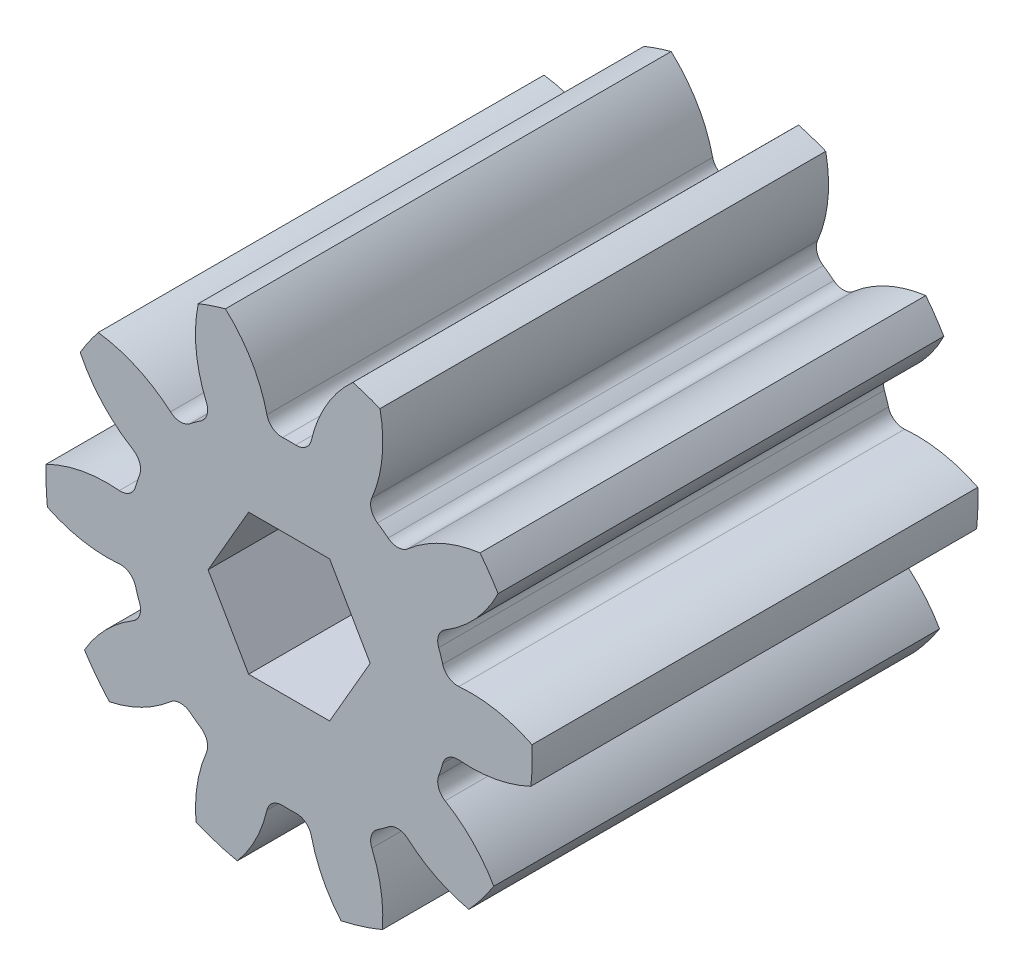
from build123d import *

# Parameters (mm, degrees)
SKETCH1_R                = 6
BOSS_EXTRUDE1_DEPTH      = 11
CUT_EXTRUDE1_DEPTH       = 11
FILLET2_R                = 0.38
CIRPATTERN2_COUNT        = 10
FILLET2_OF_CIRPATTERN2_R = 0.38
CUT_EXTRUDE2_DEPTH       = 14.833348455


with BuildPart() as part:
    # Sketch1 → Boss-Extrude1 (new body)
    with BuildSketch(Plane.XY):
        Circle(SKETCH1_R)
    extrude(amount=-BOSS_EXTRUDE1_DEPTH)

    # Sketch1<4> → Cut-Extrude1 (cut)
    with BuildSketch(Plane.XY):
        with BuildLine():
            ThreePointArc((-0.489473221, 3.71791823), (0, 3.75), (0.489473221, 3.71791823))
            ThreePointArc((0.489473221, 3.71791823), (0.847239998, 4.849979865), (1.571872072, 5.790441968))
            ThreePointArc((1.571872072, 5.790441968), (0, 6), (-1.571872072, 5.790441968))
            ThreePointArc((-1.571872072, 5.790441968), (-0.847239998, 4.849979865), (-0.489473221, 3.71791823))
        make_face()
    cut_extrude1 = extrude(amount=-CUT_EXTRUDE1_DEPTH, mode=Mode.SUBTRACT)

    # Fillet2
    fillet2_edges = [part.edges().sort_by_distance(p)[0] for p in [
        (0.489473221, 3.71791823, -5.5),
        (-0.489473221, 3.71791823, -5.5),
    ]]
    fillet(fillet2_edges, radius=FILLET2_R)

    # CirPattern2: Cut-Extrude1 ×10 about axis
    cirpattern2_axis = Axis((0, -0.18616549, 0), (0, 0, 1))
    for i in range(1, CIRPATTERN2_COUNT):
        add(cut_extrude1.rotate(cirpattern2_axis, i * 360 / CIRPATTERN2_COUNT), mode=Mode.SUBTRACT)

    # Fillet2 of CirPattern2
    fillet2_of_cirpattern2_edges = [part.edges().sort_by_distance(p)[0] for p in [
        (-1.898770681, 3.260009728, -5.5),
        (-2.690754988, 2.684599446, -5.5),
        (-3.561748719, 1.485779423, -5.5),
        (-3.864259806, 0.554746031, -5.5),
        (-3.864259806, -0.927077011, -5.5),
        (-3.561748719, -1.858110403, -5.5),
        (-2.690754988, -3.056930427, -5.5),
        (-1.898770681, -3.632340708, -5.5),
        (-0.489473221, -4.09024921, -5.5),
        (0.489473221, -4.09024921, -5.5),
        (1.898770681, -3.632340708, -5.5),
        (2.690754988, -3.056930427, -5.5),
        (3.561748719, -1.858110403, -5.5),
        (3.864259806, -0.927077011, -5.5),
        (3.864259806, 0.554746031, -5.5),
        (3.561748719, 1.485779423, -5.5),
        (2.690754988, 2.684599446, -5.5),
        (1.898770681, 3.260009728, -5.5),
    ]]
    fillet(fillet2_of_cirpattern2_edges, radius=FILLET2_OF_CIRPATTERN2_R)

    # Sketch2 → Cut-Extrude2 (cut, through all)
    with BuildSketch(Plane.XY):
        Polygon((-1, 1.732050808), (-2, 0), (-1, -1.732050808), (1, -1.732050808), (2, 0), (1, 1.732050808), align=None)
    extrude(amount=-CUT_EXTRUDE2_DEPTH, mode=Mode.SUBTRACT)


solid = part.part
